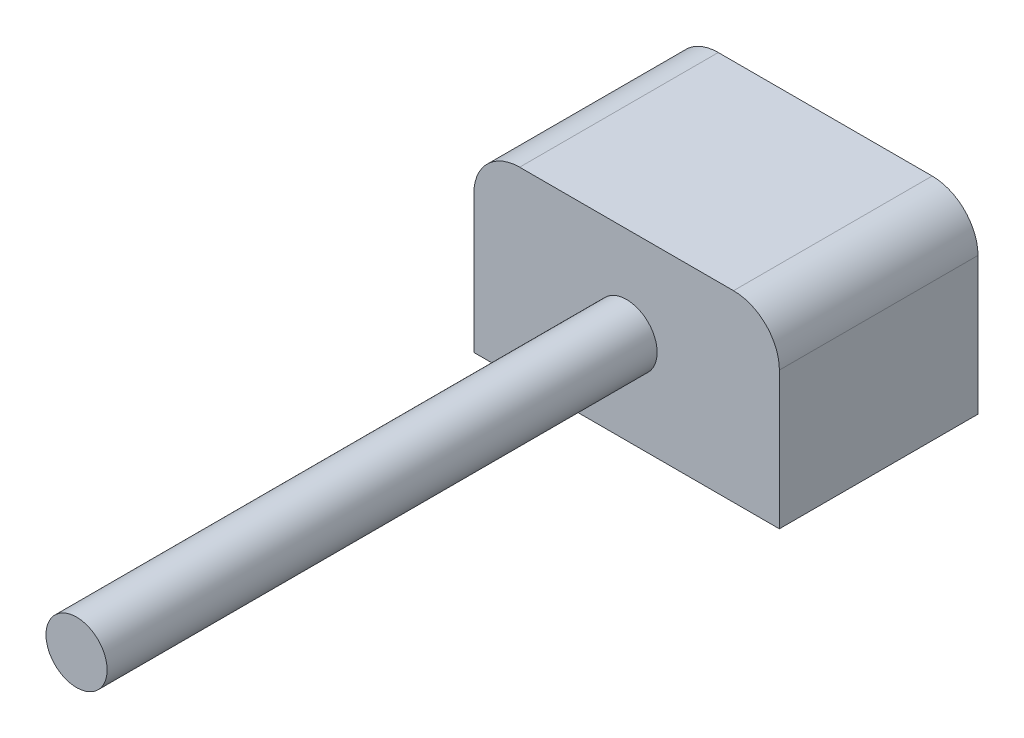
from build123d import *

# Parameters (mm, degrees)
SKIZZE1_W                       = 200
SKIZZE1_H                       = 120
AUFSATZ_LINEAR_AUSTRAGEN1_DEPTH = 130
SKIZZE2_R                       = 20
AUFSATZ_LINEAR_AUSTRAGEN2_DEPTH = 360
VERRUNDUNG1_R                   = 30


with BuildPart() as part:
    # Skizze1 → Aufsatz-Linear austragen1 (new body)
    with BuildSketch(Plane.XY):
        Rectangle(SKIZZE1_W, SKIZZE1_H)
    extrude(amount=AUFSATZ_LINEAR_AUSTRAGEN1_DEPTH)

    # Skizze2 → Aufsatz-Linear austragen2 (add)
    with BuildSketch(Plane.XY.offset(130)):
        with Locations(Location((0, 0, 0), (0, 0, 180))):
            Circle(SKIZZE2_R)
    extrude(amount=AUFSATZ_LINEAR_AUSTRAGEN2_DEPTH)

    # Verrundung1
    verrundung1_edges = [part.edges().sort_by_distance(p)[0] for p in [
        (-100, 60, 65),
        (100, 60, 65),
    ]]
    fillet(verrundung1_edges, radius=VERRUNDUNG1_R)


solid = part.part
